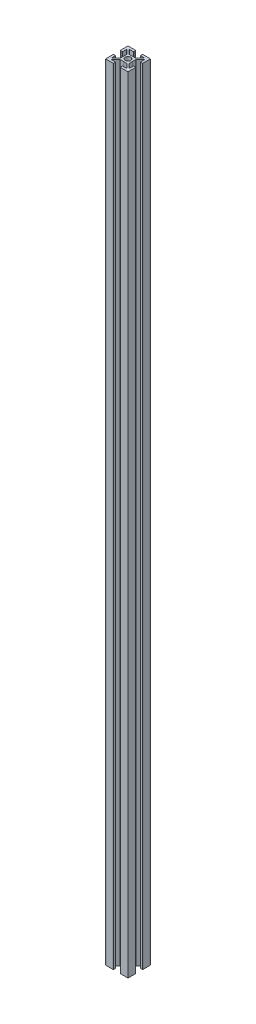
from build123d import *

# Parameters (mm, degrees)
SKETCH1_R           = 2.5
BOSS_EXTRUDE1_DEPTH = 700


with BuildPart() as part:
    # Sketch1 → Boss-Extrude1 (new body)
    with BuildSketch(Plane(origin=(0, 0, 0), x_dir=(1, 0, 0), z_dir=(0, 1, 0))):
        with BuildLine():
            Line((-2.997918472, 4.058578644), (-6.597918472, 7.658578644))
            ThreePointArc((-6.597918472, 7.658578644), (-6.621415508, 7.686854412), (-6.639339828, 7.718953455))
            ThreePointArc((-6.639339828, 7.718953455), (-6.656497116, 7.8), (-6.639339828, 7.881046545))
            ThreePointArc((-6.639339828, 7.881046545), (-6.565562901, 7.967644429), (-6.456497116, 8))
            Line((-6.456497116, 8), (-3.2, 8))
            ThreePointArc((-3.2, 8), (-3.058578644, 8.058578644), (-3, 8.2))
            Line((-3, 8.2), (-3, 9.8))
            ThreePointArc((-3, 9.8), (-3.058578644, 9.941421356), (-3.2, 10))
            Line((-3.2, 10), (-9.8, 10))
            ThreePointArc((-9.8, 10), (-9.941421356, 9.941421356), (-10, 9.8))
            Line((-10, 9.8), (-10, 3.2))
            ThreePointArc((-10, 3.2), (-9.941421356, 3.058578644), (-9.8, 3))
            Line((-9.8, 3), (-8.2, 3))
            ThreePointArc((-8.2, 3), (-8.058578644, 3.058578644), (-8, 3.2))
            Line((-8, 3.2), (-8, 6.456497116))
            ThreePointArc((-8, 6.456497116), (-7.967644429, 6.565562901), (-7.881046545, 6.639339828))
            ThreePointArc((-7.881046545, 6.639339828), (-7.8, 6.656497116), (-7.718953455, 6.639339828))
            ThreePointArc((-7.718953455, 6.639339828), (-7.686854412, 6.621415508), (-7.658578644, 6.597918472))
            Line((-7.658578644, 6.597918472), (-4.058578644, 2.997918472))
            ThreePointArc((-4.058578644, 2.997918472), (-4.015224093, 2.933033802), (-4, 2.856497116))
            Line((-4, 2.856497116), (-4, 0.130901699))
            ThreePointArc((-4, 0.130901699), (-3.99253254, 0.104615144), (-3.97236068, 0.08618034))
            Line((-3.97236068, 0.08618034), (-3.8, 0))
            Line((-3.8, 0), (-3.97236068, -0.08618034))
            ThreePointArc((-3.97236068, -0.08618034), (-3.99253254, -0.104615144), (-4, -0.130901699))
            Line((-4, -0.130901699), (-4, -2.856497116))
            ThreePointArc((-4, -2.856497116), (-4.015224093, -2.933033802), (-4.058578644, -2.997918472))
            Line((-4.058578644, -2.997918472), (-7.658578644, -6.597918472))
            ThreePointArc((-7.658578644, -6.597918472), (-7.686854412, -6.621415508), (-7.718953455, -6.639339828))
            ThreePointArc((-7.718953455, -6.639339828), (-7.8, -6.656497116), (-7.881046545, -6.639339828))
            ThreePointArc((-7.881046545, -6.639339828), (-7.967644429, -6.565562901), (-8, -6.456497116))
            Line((-8, -6.456497116), (-8, -3.2))
            ThreePointArc((-8, -3.2), (-8.058578644, -3.058578644), (-8.2, -3))
            Line((-8.2, -3), (-9.8, -3))
            ThreePointArc((-9.8, -3), (-9.941421356, -3.058578644), (-10, -3.2))
            Line((-10, -3.2), (-10, -9.8))
            ThreePointArc((-10, -9.8), (-9.941421356, -9.941421356), (-9.8, -10))
            Line((-9.8, -10), (-3.2, -10))
            ThreePointArc((-3.2, -10), (-3.058578644, -9.941421356), (-3, -9.8))
            Line((-3, -9.8), (-3, -8.2))
            ThreePointArc((-3, -8.2), (-3.058578644, -8.058578644), (-3.2, -8))
            Line((-3.2, -8), (-6.456497116, -8))
            ThreePointArc((-6.456497116, -8), (-6.565562901, -7.967644429), (-6.639339828, -7.881046545))
            ThreePointArc((-6.639339828, -7.881046545), (-6.656497116, -7.8), (-6.639339828, -7.718953455))
            ThreePointArc((-6.639339828, -7.718953455), (-6.621415508, -7.686854412), (-6.597918472, -7.658578644))
            Line((-6.597918472, -7.658578644), (-2.997918472, -4.058578644))
            ThreePointArc((-2.997918472, -4.058578644), (-2.933033802, -4.015224093), (-2.856497116, -4))
            Line((-2.856497116, -4), (-0.211803399, -4))
            ThreePointArc((-0.211803399, -4), (-0.200315753, -3.998662449), (-0.189442719, -3.99472136))
            Line((-0.189442719, -3.99472136), (0, -3.9))
            Line((0, -3.9), (0.189442719, -3.99472136))
            ThreePointArc((0.189442719, -3.99472136), (0.200315753, -3.998662449), (0.211803399, -4))
            Line((0.211803399, -4), (2.856497116, -4))
            ThreePointArc((2.856497116, -4), (2.933033802, -4.015224093), (2.997918472, -4.058578644))
            Line((2.997918472, -4.058578644), (6.597918472, -7.658578644))
            ThreePointArc((6.597918472, -7.658578644), (6.621415508, -7.686854412), (6.639339828, -7.718953455))
            ThreePointArc((6.639339828, -7.718953455), (6.656497116, -7.8), (6.639339828, -7.881046545))
            ThreePointArc((6.639339828, -7.881046545), (6.565562901, -7.967644429), (6.456497116, -8))
            Line((6.456497116, -8), (3.2, -8))
            ThreePointArc((3.2, -8), (3.058578644, -8.058578644), (3, -8.2))
            Line((3, -8.2), (3, -9.8))
            ThreePointArc((3, -9.8), (3.058578644, -9.941421356), (3.2, -10))
            Line((3.2, -10), (9.8, -10))
            ThreePointArc((9.8, -10), (9.941421356, -9.941421356), (10, -9.8))
            Line((10, -9.8), (10, -3.2))
            ThreePointArc((10, -3.2), (9.941421356, -3.058578644), (9.8, -3))
            Line((9.8, -3), (8.2, -3))
            ThreePointArc((8.2, -3), (8.058578644, -3.058578644), (8, -3.2))
            Line((8, -3.2), (8, -6.456497116))
            ThreePointArc((8, -6.456497116), (7.967644429, -6.565562901), (7.881046545, -6.639339828))
            ThreePointArc((7.881046545, -6.639339828), (7.8, -6.656497116), (7.718953455, -6.639339828))
            ThreePointArc((7.718953455, -6.639339828), (7.686854412, -6.621415508), (7.658578644, -6.597918472))
            Line((7.658578644, -6.597918472), (4.058578644, -2.997918472))
            ThreePointArc((4.058578644, -2.997918472), (4.015224093, -2.933033802), (4, -2.856497116))
            Line((4, -2.856497116), (4, -0.130901699))
            ThreePointArc((4, -0.130901699), (3.99253254, -0.104615144), (3.97236068, -0.08618034))
            Line((3.97236068, -0.08618034), (3.8, 0))
            Line((3.8, 0), (3.97236068, 0.08618034))
            ThreePointArc((3.97236068, 0.08618034), (3.99253254, 0.104615144), (4, 0.130901699))
            Line((4, 0.130901699), (4, 2.856497116))
            ThreePointArc((4, 2.856497116), (4.015224093, 2.933033802), (4.058578644, 2.997918472))
            Line((4.058578644, 2.997918472), (7.658578644, 6.597918472))
            ThreePointArc((7.658578644, 6.597918472), (7.686854412, 6.621415508), (7.718953455, 6.639339828))
            ThreePointArc((7.718953455, 6.639339828), (7.8, 6.656497116), (7.881046545, 6.639339828))
            ThreePointArc((7.881046545, 6.639339828), (7.967644429, 6.565562901), (8, 6.456497116))
            Line((8, 6.456497116), (8, 3.2))
            ThreePointArc((8, 3.2), (8.058578644, 3.058578644), (8.2, 3))
            Line((8.2, 3), (9.8, 3))
            ThreePointArc((9.8, 3), (9.941421356, 3.058578644), (10, 3.2))
            Line((10, 3.2), (10, 9.8))
            ThreePointArc((10, 9.8), (9.941421356, 9.941421356), (9.8, 10))
            Line((9.8, 10), (3.2, 10))
            ThreePointArc((3.2, 10), (3.058578644, 9.941421356), (3, 9.8))
            Line((3, 9.8), (3, 8.2))
            ThreePointArc((3, 8.2), (3.058578644, 8.058578644), (3.2, 8))
            Line((3.2, 8), (6.456497116, 8))
            ThreePointArc((6.456497116, 8), (6.565562901, 7.967644429), (6.639339828, 7.881046545))
            ThreePointArc((6.639339828, 7.881046545), (6.656497116, 7.8), (6.639339828, 7.718953455))
            ThreePointArc((6.639339828, 7.718953455), (6.621415508, 7.686854412), (6.597918472, 7.658578644))
            Line((6.597918472, 7.658578644), (2.997918472, 4.058578644))
            ThreePointArc((2.997918472, 4.058578644), (2.933033802, 4.015224093), (2.856497116, 4))
            Line((2.856497116, 4), (0.211803399, 4))
            ThreePointArc((0.211803399, 4), (0.200315753, 3.998662449), (0.189442719, 3.99472136))
            Line((0.189442719, 3.99472136), (0, 3.9))
            Line((0, 3.9), (-0.189442719, 3.99472136))
            ThreePointArc((-0.189442719, 3.99472136), (-0.200315753, 3.998662449), (-0.211803399, 4))
            Line((-0.211803399, 4), (-2.856497116, 4))
            ThreePointArc((-2.856497116, 4), (-2.933033802, 4.015224093), (-2.997918472, 4.058578644))
        make_face()
        Circle(SKETCH1_R, mode=Mode.SUBTRACT)
    extrude(amount=BOSS_EXTRUDE1_DEPTH)


solid = part.part
